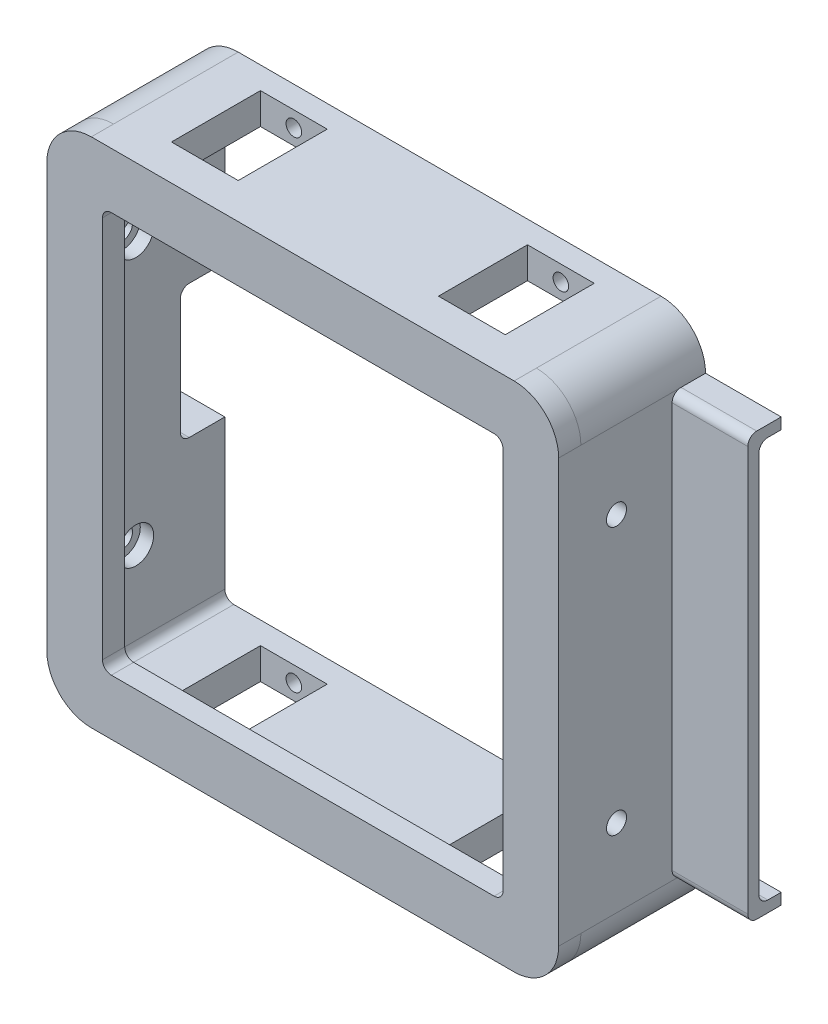
from build123d import *

# Parameters (mm, degrees)
SKETCH1_W                                  = 115
SKETCH1_H                                  = 115
BOSS_EXTRUDE1_DEPTH                        = 28
FILLET1_R                                  = 10
SKETCH2_W                                  = 101
SKETCH2_H                                  = 101
CUT_EXTRUDE1_DEPTH                         = 30
FILLET2_R                                  = 2
SKETCH3_W                                  = 10
SKETCH3_H                                  = 90
CUT_EXTRUDE2_DEPTH                         = 30
SKETCH4_W                                  = 5
SKETCH4_H                                  = 2.5
BOSS_EXTRUDE2_DEPTH                        = 17
FILLET3_R                                  = 2
SKETCH5_W                                  = 20
SKETCH5_H                                  = 30
CUT_EXTRUDE3_DEPTH                         = 22
SKETCH6_W                                  = 10
SKETCH6_H                                  = 2.5
BOSS_EXTRUDE3_DEPTH                        = 19
FILLET4_R                                  = 2
SKETCH7_W                                  = 15
SKETCH7_H                                  = 20
CUT_EXTRUDE4_DEPTH                         = 120
SKETCH9_R                                  = 1.75
CUT_EXTRUDE6_DEPTH                         = 10
MIRROR2_AT_THE_SECOND_PLANE_COPY_1_SKETC_R = 1.75
MIRROR2_AT_THE_SECOND_PLANE_COPY_1_DEPTH   = 10
SKETCH11_R                                 = 2.25
CUT_EXTRUDE7_DEPTH                         = 125
SKETCH12_R                                 = 4
CUT_EXTRUDE8_DEPTH                         = 3
MIRROR4_AT_THE_SECOND_PLANE_COPY_1_SKETC_R = 4
MIRROR4_AT_THE_SECOND_PLANE_COPY_1_DEPTH   = 3
SKETCH14_W                                 = 115
SKETCH14_H                                 = 115
SKETCH14_W_2                               = 90
SKETCH14_H_2                               = 90
BOSS_EXTRUDE4_DEPTH                        = 5
FILLET5_R                                  = 10
FILLET6_R                                  = 2


with BuildPart() as part:
    # Sketch1 → Boss-Extrude1 (new body)
    with BuildSketch(Plane.XY):
        Rectangle(SKETCH1_W, SKETCH1_H)
    extrude(amount=BOSS_EXTRUDE1_DEPTH)

    # Fillet1
    fillet1_edges = [part.edges().sort_by_distance(p)[0] for p in [
        (-57.5, 57.5, 14),
        (57.5, 57.5, 14),
        (57.5, -57.5, 14),
        (-57.5, -57.5, 14),
    ]]
    fillet(fillet1_edges, radius=FILLET1_R)

    # Sketch2 → Cut-Extrude1 (cut)
    with BuildSketch(Plane.XY.offset(28)):
        Rectangle(SKETCH2_W, SKETCH2_H)
    extrude(amount=-CUT_EXTRUDE1_DEPTH, mode=Mode.SUBTRACT)

    # Fillet2
    fillet2_edges = [part.edges().sort_by_distance(p)[0] for p in [
        (-50.5, -50.5, 14),
        (-50.5, 50.5, 14),
        (50.5, 50.5, 14),
        (50.5, -50.5, 14),
    ]]
    fillet(fillet2_edges, radius=FILLET2_R)

    # Sketch3 → Cut-Extrude2 (cut)
    with BuildSketch(Plane(origin=(57.5, 0, 0), x_dir=(0, 0, -1), z_dir=(1, 0, 0))):
        Rectangle(SKETCH3_W, SKETCH3_H)
    extrude(amount=-CUT_EXTRUDE2_DEPTH, mode=Mode.SUBTRACT)

    # Sketch4 → Boss-Extrude2 (add)
    with BuildSketch(Plane(origin=(57.5, 0, 0), x_dir=(0, 0, -1), z_dir=(1, 0, 0))):
        Polygon((-5, -45), (-5, 45), (-5, 47.5), (-7.5, 47.5), (-7.5, -47.5), (-5, -47.5), align=None)
        with Locations((-2.5, 46.25)):
            Rectangle(SKETCH4_W, SKETCH4_H)
        with Locations((-2.5, -46.25)):
            Rectangle(SKETCH4_W, SKETCH4_H)
    extrude(amount=BOSS_EXTRUDE2_DEPTH)

    # Fillet3
    fillet3_edges = [part.edges().sort_by_distance(p)[0] for p in [
        (66, 47.5, 7.5),
        (66, -47.5, 7.5),
        (62.5, -45, 5),
        (62.5, 45, 5),
    ]]
    fillet(fillet3_edges, radius=FILLET3_R)

    # Sketch5 → Cut-Extrude3 (cut)
    with BuildSketch(Plane.ZY.offset(57.5)):
        Rectangle(SKETCH5_W, SKETCH5_H)
    extrude(amount=-CUT_EXTRUDE3_DEPTH, mode=Mode.SUBTRACT)

    # Sketch6 → Boss-Extrude3 (add)
    with BuildSketch(Plane.ZY.offset(57.5)):
        Polygon((10, 17.5), (10, 15), (10, -15), (10, -17.5), (12.5, -17.5), (12.5, 17.5), align=None)
        with Locations((5, 16.25)):
            Rectangle(SKETCH6_W, SKETCH6_H)
        with Locations((5, -16.25)):
            Rectangle(SKETCH6_W, SKETCH6_H)
    extrude(amount=BOSS_EXTRUDE3_DEPTH)

    # Fillet4
    fillet4_edges = [part.edges().sort_by_distance(p)[0] for p in [
        (-63.5, 15, 10),
        (-63.5, -15, 10),
        (-67, -17.5, 12.5),
        (-67, 17.5, 12.5),
    ]]
    fillet(fillet4_edges, radius=FILLET4_R)

    # Sketch7 → Cut-Extrude4 (cut)
    with BuildSketch(Plane(origin=(0, 57.5, 0), x_dir=(1, 0, 0), z_dir=(0, 1, 0))):
        with Locations((-30, -15)):
            Rectangle(SKETCH7_W, SKETCH7_H)
        with Locations((30, -15)):
            Rectangle(SKETCH7_W, SKETCH7_H)
    extrude(amount=-CUT_EXTRUDE4_DEPTH, mode=Mode.SUBTRACT)

    # Sketch9 → Cut-Extrude6 (cut)
    with BuildSketch(Plane(origin=(0, 0, 0), x_dir=(-1, 0, 0), z_dir=(0, 0, -1))):
        with Locations((-30, 54)):
            Circle(SKETCH9_R)
    cut_extrude6 = extrude(amount=-CUT_EXTRUDE6_DEPTH, mode=Mode.SUBTRACT)

    # Mirror2: Cut-Extrude6 across plane
    add(cut_extrude6.mirror(Plane(origin=(0, 0, 0), x_dir=(0, 0, 1), z_dir=(1, 0, 0))), mode=Mode.SUBTRACT)

    # Mirror2 at the second plane: Cut-Extrude6 across plane
    add(cut_extrude6.mirror(Plane.ZX), mode=Mode.SUBTRACT)

    # Mirror2 at the second plane copy 1 sketc → Mirror2 at the second plane copy 1 (cut)
    with BuildSketch(Plane(origin=(0, 0, 0), x_dir=(1, 0, 0), z_dir=(0, 0, -1))):
        with Locations((-30, 54)):
            Circle(MIRROR2_AT_THE_SECOND_PLANE_COPY_1_SKETC_R)
    extrude(amount=-MIRROR2_AT_THE_SECOND_PLANE_COPY_1_DEPTH, mode=Mode.SUBTRACT)

    # Sketch11 → Cut-Extrude7 (cut)
    with BuildSketch(Plane.ZY.offset(57.5)):
        with Locations((20, 30)):
            Circle(SKETCH11_R)
    cut_extrude7 = extrude(amount=-CUT_EXTRUDE7_DEPTH, mode=Mode.SUBTRACT)

    # Mirror3: Cut-Extrude7 across plane
    add(cut_extrude7.mirror(Plane.ZX), mode=Mode.SUBTRACT)

    # Sketch12 → Cut-Extrude8 (cut)
    with BuildSketch(Plane(origin=(-50.5, 0, 0), x_dir=(0, 0, -1), z_dir=(1, 0, 0))):
        with Locations((-20, 30)):
            Circle(SKETCH12_R)
    cut_extrude8 = extrude(amount=-CUT_EXTRUDE8_DEPTH, mode=Mode.SUBTRACT)

    # Mirror4: Cut-Extrude8 across plane
    add(cut_extrude8.mirror(Plane(origin=(0, 0, 0), x_dir=(0, 0, 1), z_dir=(1, 0, 0))), mode=Mode.SUBTRACT)

    # Mirror4 at the second plane: Cut-Extrude8 across plane
    add(cut_extrude8.mirror(Plane.ZX), mode=Mode.SUBTRACT)

    # Mirror4 at the second plane copy 1 sketc → Mirror4 at the second plane copy 1 (cut)
    with BuildSketch(Plane(origin=(50.5, 0, 0), x_dir=(0, 0, -1), z_dir=(-1, 0, 0))):
        with Locations((-20, 30)):
            Circle(MIRROR4_AT_THE_SECOND_PLANE_COPY_1_SKETC_R)
    extrude(amount=-MIRROR4_AT_THE_SECOND_PLANE_COPY_1_DEPTH, mode=Mode.SUBTRACT)

    # Sketch14 → Boss-Extrude4 (add)
    with BuildSketch(Plane.XY.offset(28)):
        Rectangle(SKETCH14_W, SKETCH14_H)
        Rectangle(SKETCH14_W_2, SKETCH14_H_2, mode=Mode.SUBTRACT)
    extrude(amount=BOSS_EXTRUDE4_DEPTH)

    # Fillet5
    fillet5_edges = [part.edges().sort_by_distance(p)[0] for p in [
        (-57.5, -57.5, 30.5),
        (57.5, -57.5, 30.5),
        (-57.5, 57.5, 30.5),
        (57.5, 57.5, 30.5),
    ]]
    fillet(fillet5_edges, radius=FILLET5_R)

    # Fillet6
    fillet6_edges = [part.edges().sort_by_distance(p)[0] for p in [
        (-45, -45, 30.5),
        (45, -45, 30.5),
        (45, 45, 30.5),
        (-45, 45, 30.5),
    ]]
    fillet(fillet6_edges, radius=FILLET6_R)


solid = part.part
